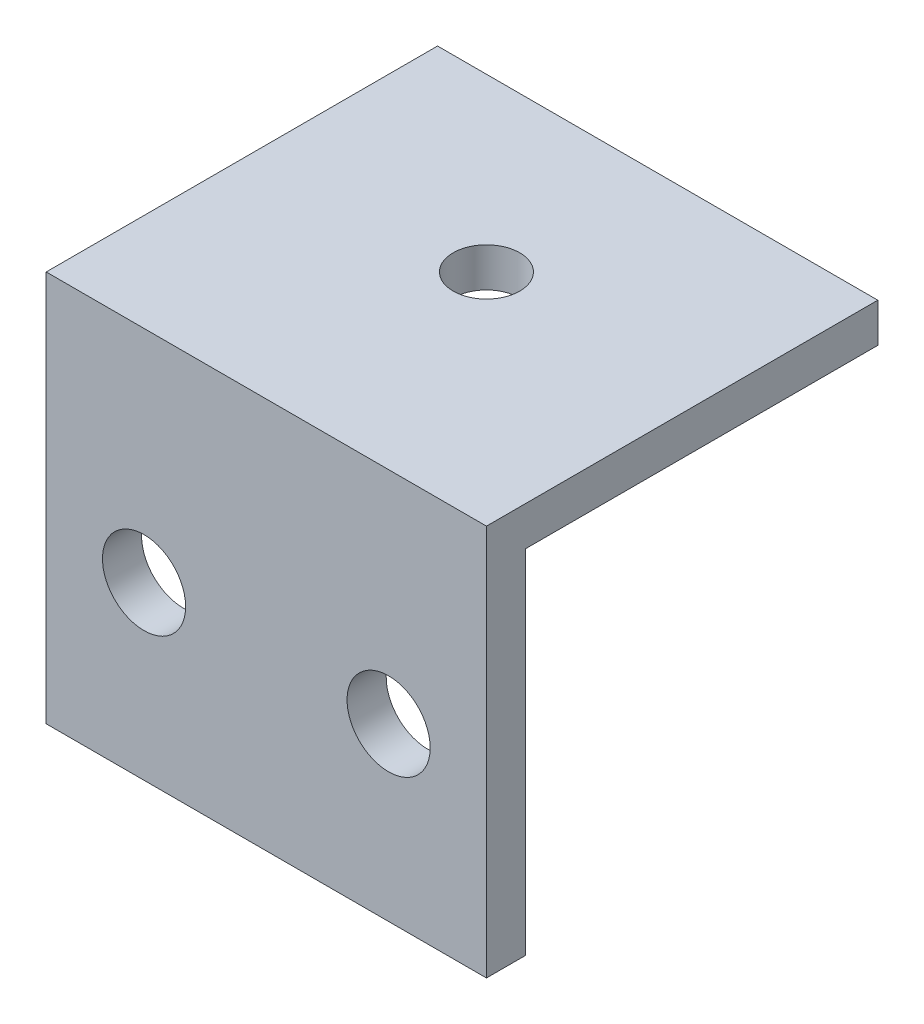
from build123d import *

# Parameters (mm, degrees)
BOSS_EXTRUDE1_DEPTH        = 22.5
M8_TAPPED_HOLE1_D          = 6.8
F_8_5_8_5_DIAMETER_HOLE2_D = 8.5


with BuildPart() as part:
    # Sketch1 → Boss-Extrude1 (new, symmetric)
    with BuildSketch(Plane(origin=(0, 0, 0), x_dir=(0, 0, -1), z_dir=(1, 0, 0))):
        Polygon((0, -40), (0, 0), (40, 0), (40, -4), (4, -4), (4, -40), align=None)
    extrude(amount=BOSS_EXTRUDE1_DEPTH, both=True)

    # M8 Tapped Hole1 (through all)
    with Locations(Plane(origin=(0, 0, 0), x_dir=(1, 0, 0), z_dir=(0, 1, 0))):
        with Locations((0, 22.5)):
            Hole(M8_TAPPED_HOLE1_D / 2)

    # Ø8.5 (8.5) Diameter Hole2 (through all)
    with Locations(Plane.XY):
        with Locations((-12.5, -22.5), (12.5, -22.5)):
            Hole(F_8_5_8_5_DIAMETER_HOLE2_D / 2)


solid = part.part
